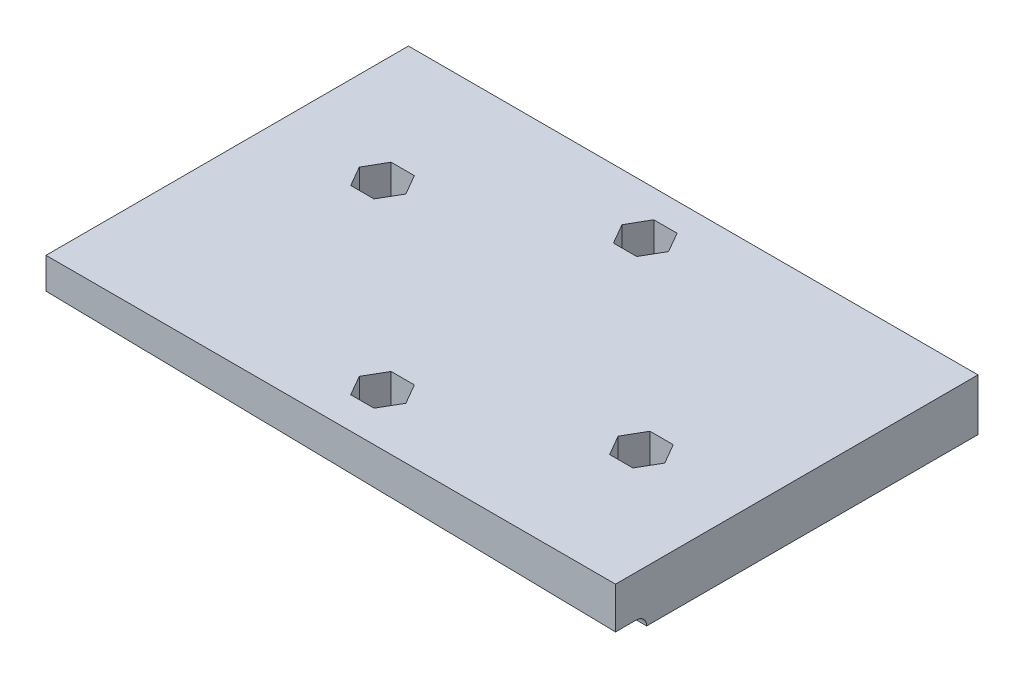
from build123d import *

# Parameters (mm, degrees)
SKETCH1_W           = 110
SKETCH1_H           = 70
BOSS_EXTRUDE1_DEPTH = 10
SKETCH5_R           = 1.9
CUT_EXTRUDE4_DEPTH  = 77.548290163
CUT_EXTRUDE6_DEPTH  = 6
SKETCH17_R          = 1.9
CUT_EXTRUDE8_DEPTH  = 77.548290163
FILLET1_R           = 2
SKETCH24_R          = 1.9
CUT_EXTRUDE12_DEPTH = 77.548290163
SKETCH25_R          = 1.9
CUT_EXTRUDE13_DEPTH = 77.548290163
CUT_EXTRUDE15_DEPTH = 6
CUT_EXTRUDE16_DEPTH = 6
CUT_EXTRUDE17_DEPTH = 6
CUT_EXTRUDE18_DEPTH = 6


with BuildPart() as part:
    # Sketch1 → Boss-Extrude1 (new body)
    with BuildSketch(Plane(origin=(0, 0, 0), x_dir=(1, 0, 0), z_dir=(0, 1, 0))):
        with Locations((9.869408673, 4.390361071)):
            Rectangle(SKETCH1_W, SKETCH1_H)
    extrude(amount=BOSS_EXTRUDE1_DEPTH)

    # Sketch5 → Cut-Extrude4 (cut, through all)
    with BuildSketch(Plane(origin=(0, 10, 0), x_dir=(1, 0, 0), z_dir=(0, 1, 0))):
        with Locations(Location((9.869408673, -20.609638929, 0), (0, 0, 270))):
            Circle(SKETCH5_R)
    extrude(amount=-CUT_EXTRUDE4_DEPTH, mode=Mode.SUBTRACT)

    # Sketch14 → Cut-Extrude6 (cut)
    with BuildSketch(Plane.XY.offset(30.609638929)):
        Polygon((-45.130591327, 0), (-45.130591327, 4), (64.869408673, 2), (64.869408673, 0), align=None)
    extrude(amount=-CUT_EXTRUDE6_DEPTH, mode=Mode.SUBTRACT)

    # Sketch17 → Cut-Extrude8 (cut, through all)
    with BuildSketch(Plane(origin=(0, 0, 0), x_dir=(-1, 0, 0), z_dir=(0, -1, 0))):
        with Locations(Location((-9.869408673, 30.128732458, 0), (0, 0, 90))):
            Circle(SKETCH17_R)
    extrude(amount=-CUT_EXTRUDE8_DEPTH, mode=Mode.SUBTRACT)

    # Fillet1
    fillet1_edges = [part.edges().sort_by_distance(p)[0] for p in [
        (9.869408673, 3, 24.609638929),
    ]]
    fillet(fillet1_edges, radius=FILLET1_R)

    # Sketch24 → Cut-Extrude12 (cut, through all)
    with BuildSketch(Plane.XZ):
        with Locations(Location((44.869408673, 5.609638929, 0), (0, 0, 270))):
            Circle(SKETCH24_R)
    extrude(amount=-CUT_EXTRUDE12_DEPTH, mode=Mode.SUBTRACT)

    # Sketch25 → Cut-Extrude13 (cut, through all)
    with BuildSketch(Plane.XZ):
        with Locations(Location((-25.130591327, -14.390361071, 0), (0, 0, 270))):
            Circle(SKETCH25_R)
    extrude(amount=-CUT_EXTRUDE13_DEPTH, mode=Mode.SUBTRACT)

    # Sketch27 → Cut-Extrude15 (cut)
    with BuildSketch(Plane(origin=(0, 10, 0), x_dir=(1, 0, 0), z_dir=(0, 1, 0))):
        Polygon((14.369408673, 30.128732458), (12.119408673, 34.025846775), (7.619408673, 34.025846775), (5.369408673, 30.128732458), (7.619408673, 26.231618141), (12.119408673, 26.231618141), align=None)
    extrude(amount=-CUT_EXTRUDE15_DEPTH, mode=Mode.SUBTRACT)

    # Sketch30 → Cut-Extrude16 (cut)
    with BuildSketch(Plane(origin=(0, 10, 0), x_dir=(1, 0, 0), z_dir=(0, 1, 0))):
        Polygon((49.369408673, -5.609638929), (47.119408673, -1.712524612), (42.619408673, -1.712524612), (40.369408673, -5.609638929), (42.619408673, -9.506753246), (47.119408673, -9.506753246), align=None)
    extrude(amount=-CUT_EXTRUDE16_DEPTH, mode=Mode.SUBTRACT)

    # Sketch31 → Cut-Extrude17 (cut)
    with BuildSketch(Plane(origin=(0, 10, 0), x_dir=(1, 0, 0), z_dir=(0, 1, 0))):
        Polygon((14.369408673, -20.609638929), (12.119408673, -16.712524612), (7.619408673, -16.712524612), (5.369408673, -20.609638929), (7.619408673, -24.506753246), (12.119408673, -24.506753246), align=None)
    extrude(amount=-CUT_EXTRUDE17_DEPTH, mode=Mode.SUBTRACT)

    # Sketch32 → Cut-Extrude18 (cut)
    with BuildSketch(Plane(origin=(0, 10, 0), x_dir=(1, 0, 0), z_dir=(0, 1, 0))):
        Polygon((-20.630591327, 14.390361071), (-22.880591327, 18.287475388), (-27.380591327, 18.287475388), (-29.630591327, 14.390361071), (-27.380591327, 10.493246754), (-22.880591327, 10.493246754), align=None)
    extrude(amount=-CUT_EXTRUDE18_DEPTH, mode=Mode.SUBTRACT)


solid = part.part
